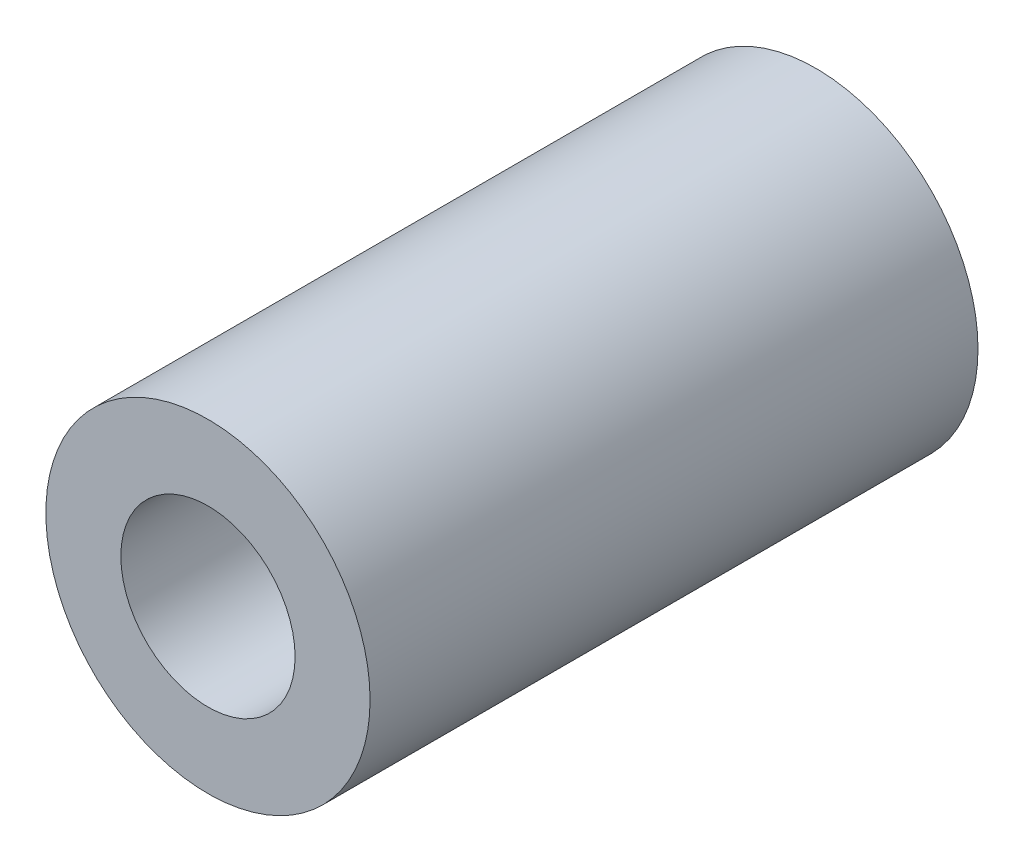
from build123d import *

# Parameters (mm, degrees)
SKETCH_1_R      = 4
SKETCH_1_R_2    = 2.15
EXTRUDE_1_DEPTH = 7.5


with BuildPart() as part:
    # Эскиз1 → Бобышка-Вытянуть1 (new, symmetric)
    with BuildSketch(Plane.XY):
        Circle(SKETCH_1_R)
        Circle(SKETCH_1_R_2, mode=Mode.SUBTRACT)
    extrude(amount=EXTRUDE_1_DEPTH, both=True)


solid = part.part
